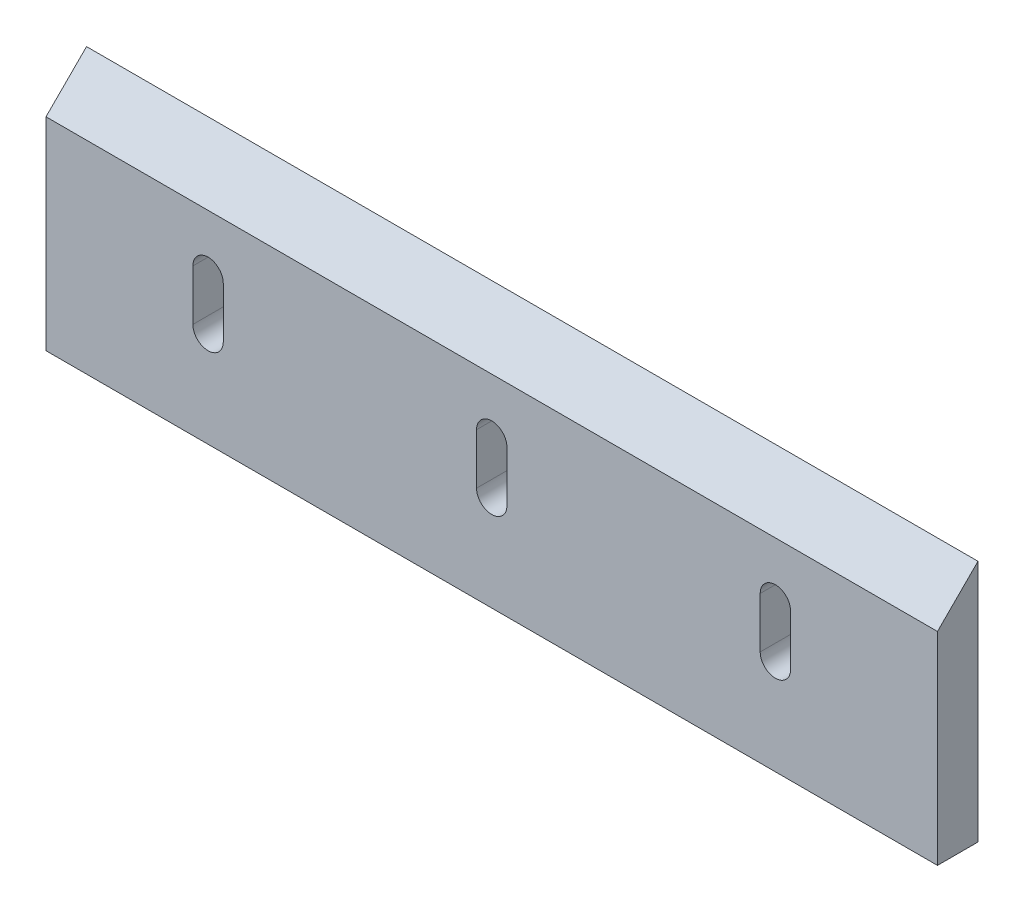
from build123d import *

# Parameters (mm, degrees)
SKETCH1_W           = 279.4
SKETCH1_H           = 76.2
BOSS_EXTRUDE1_DEPTH = 6.35
CUT_EXTRUDE2_DEPTH  = 139.7
CUT_EXTRUDE3_DEPTH  = 38.1


with BuildPart() as part:
    # Sketch1 → Boss-Extrude1 (new, symmetric)
    with BuildSketch(Plane.XY):
        Rectangle(SKETCH1_W, SKETCH1_H)
    extrude(amount=BOSS_EXTRUDE1_DEPTH, both=True)

    # Sketch2 → Cut-Extrude2 (cut, symmetric)
    with BuildSketch(Plane(origin=(0, 0, 0), x_dir=(0, 0, -1), z_dir=(1, 0, 0))):
        Polygon((6.35, 38.1), (-6.35, 25.4), (-6.35, 38.1), align=None)
    extrude(amount=CUT_EXTRUDE2_DEPTH, both=True, mode=Mode.SUBTRACT)

    # Sketch3 → Cut-Extrude3 (cut, symmetric)
    with BuildSketch(Plane.XY):
        with BuildLine():
            Line((84.1375, -7.9375), (84.1375, 7.9375))
            ThreePointArc((84.1375, 7.9375), (88.9, 12.7), (93.6625, 7.9375))
            Line((93.6625, 7.9375), (93.6625, -7.9375))
            ThreePointArc((93.6625, -7.9375), (88.9, -12.7), (84.1375, -7.9375))
        make_face()
        with BuildLine():
            Line((-4.7625, -7.9375), (-4.7625, 7.9375))
            ThreePointArc((-4.7625, 7.9375), (0, 12.7), (4.7625, 7.9375))
            Line((4.7625, 7.9375), (4.7625, -7.9375))
            ThreePointArc((4.7625, -7.9375), (0, -12.7), (-4.7625, -7.9375))
        make_face()
        with BuildLine():
            Line((-93.6625, -7.9375), (-93.6625, 7.9375))
            ThreePointArc((-93.6625, 7.9375), (-88.9, 12.7), (-84.1375, 7.9375))
            Line((-84.1375, 7.9375), (-84.1375, -7.9375))
            ThreePointArc((-84.1375, -7.9375), (-88.9, -12.7), (-93.6625, -7.9375))
        make_face()
    extrude(amount=CUT_EXTRUDE3_DEPTH, both=True, mode=Mode.SUBTRACT)


solid = part.part
